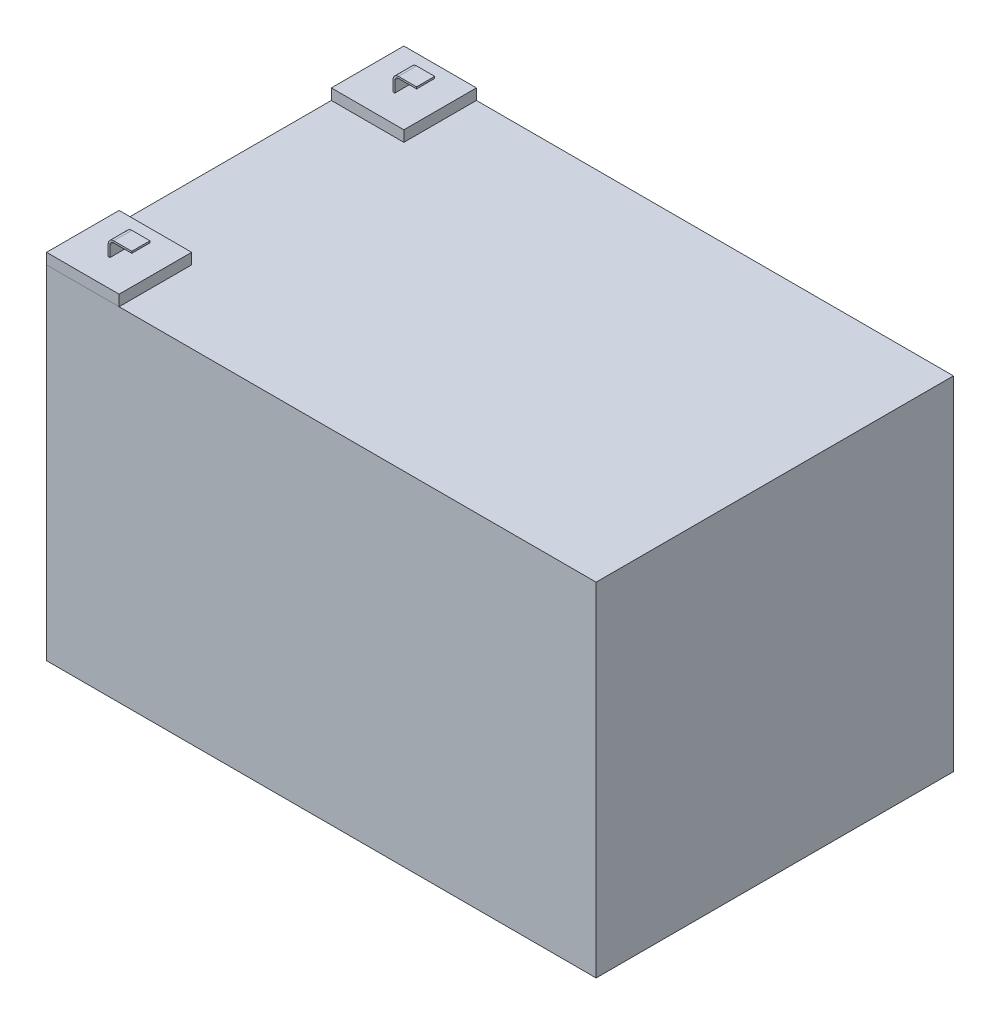
from build123d import *

# Parameters (mm, degrees)
SKETCH1_W                = 151.5
SKETCH1_H                = 98.5
BOSS_EXTRUDE1_DEPTH      = 94.5
SKETCH2_W                = 20
SKETCH2_H                = 20
BOSS_EXTRUDE2_DEPTH      = 3
BOSS_EXTRUDE2_2_DEPTH    = 3
BOSS_EXTRUDE3_DEPTH      = 2.5
BOSS_EXTRUDE3_DEPTH_BACK = 2.5


with BuildPart() as part:
    # Sketch1 → Boss-Extrude1 (new body)
    with BuildSketch(Plane(origin=(0, 0, 0), x_dir=(1, 0, 0), z_dir=(0, 1, 0))):
        Rectangle(SKETCH1_W, SKETCH1_H)
    extrude(amount=BOSS_EXTRUDE1_DEPTH)


with BuildPart() as body_2:
    # Sketch2 → Boss-Extrude2 (new body)
    with BuildSketch(Plane(origin=(0, 94.5, 0), x_dir=(1, 0, 0), z_dir=(0, 1, 0))):
        with Locations((-65.75, 39.25)):
            Rectangle(SKETCH2_W, SKETCH2_H)
    extrude(amount=BOSS_EXTRUDE2_DEPTH)


with BuildPart() as body_3:
    # Sketch2 → Boss-Extrude2 2 (new body)
    with BuildSketch(Plane(origin=(0, 94.5, 0), x_dir=(1, 0, 0), z_dir=(0, 1, 0))):
        with Locations((-65.75, -39.25)):
            Rectangle(SKETCH2_W, SKETCH2_H)
    extrude(amount=BOSS_EXTRUDE2_2_DEPTH)


with BuildPart() as body_4:
    # Sketch3 → Boss-Extrude3 (new, two sides: drawn at the far end of the back side and taken through both)
    with BuildSketch(Plane.XY.offset(39.25).offset(-BOSS_EXTRUDE3_DEPTH_BACK)):
        with BuildLine():
            Line((-65.75, 97.5), (-65.75, 100.5))
            ThreePointArc((-65.75, 100.5), (-65.457106781, 101.207106781), (-64.75, 101.5))
            Line((-64.75, 101.5), (-59.75, 101.5))
            Line((-59.75, 101.5), (-59.75, 102))
            Line((-59.75, 102), (-64.75, 102))
            ThreePointArc((-64.75, 102), (-65.810660172, 101.560660172), (-66.25, 100.5))
            Line((-66.25, 100.5), (-66.25, 97.5))
            Line((-66.25, 97.5), (-65.75, 97.5))
        make_face()
    extrude(amount=BOSS_EXTRUDE3_DEPTH + BOSS_EXTRUDE3_DEPTH_BACK)


with BuildPart() as body_5:
    # Mirror2: mirrored copy
    add(body_4.part.mirror(Plane.XY))


solid = Compound([part.part, body_2.part, body_3.part, body_4.part, body_5.part])
